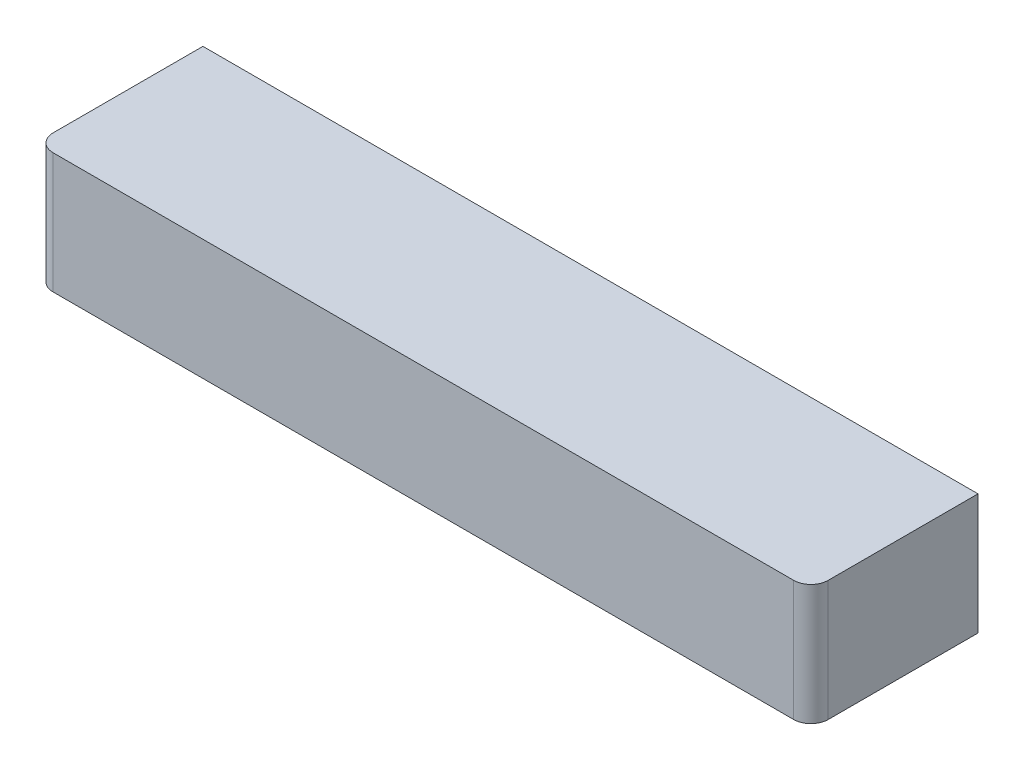
from build123d import *

# Parameters (mm, degrees)
SKETCH1_W           = 450
SKETCH1_H           = 97
BOSS_EXTRUDE1_DEPTH = 70
FILLET1_R           = 10
SKETCH2_R           = 1.5
CUT_EXTRUDE1_DEPTH  = 20


with BuildPart() as part:
    # Sketch1 → Boss-Extrude1 (new body)
    with BuildSketch(Plane(origin=(0, 0, 0), x_dir=(1, 0, 0), z_dir=(0, 1, 0))):
        with Locations((-30.312317216, -35.86444631)):
            Rectangle(SKETCH1_W, SKETCH1_H)
    extrude(amount=BOSS_EXTRUDE1_DEPTH)

    # Fillet1
    fillet1_edges = [part.edges().sort_by_distance(p)[0] for p in [
        (194.687682784, 35, 84.36444631),
        (-255.312317216, 35, 84.36444631),
    ]]
    fillet(fillet1_edges, radius=FILLET1_R)

    # Sketch2 → Cut-Extrude1 (cut)
    with BuildSketch(Plane(origin=(0, 0, 0), x_dir=(-1, 0, 0), z_dir=(0, -1, 0))):
        with Locations(Location((-184.687682784, -44.36444631, 0), (0, 0, 90))):
            Circle(SKETCH2_R)
        with Locations(Location((245.312317216, -44.36444631, 0), (0, 0, 90))):
            Circle(SKETCH2_R)
    extrude(amount=-CUT_EXTRUDE1_DEPTH, mode=Mode.SUBTRACT)


solid = part.part
